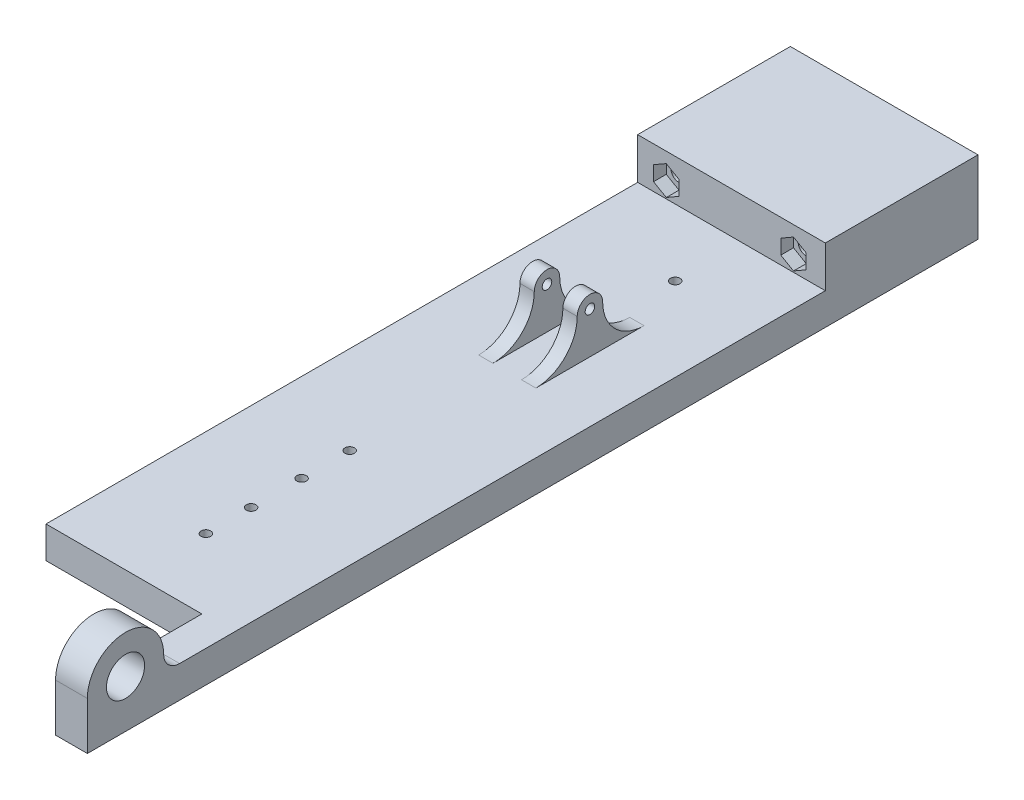
from build123d import *

# Parameters (mm, degrees)
SKETCH1_R           = 6
SKETCH1_R_2         = 1.5
BOSS_EXTRUDE1_DEPTH = 59
SKETCH2_W           = 49
SKETCH2_H           = 46
CUT_EXTRUDE1_DEPTH  = 291.342900723
SKETCH3_W           = 9
SKETCH3_H           = 50
SKETCH3_W_2         = 22
SKETCH3_W_3         = 19
CUT_EXTRUDE2_DEPTH  = 290.584184651
CUT_EXTRUDE3_DEPTH  = 4
SKETCH7_R           = 2.55
CUT_EXTRUDE4_DEPTH  = 82
CUT_EXTRUDE5_DEPTH  = 4
SKETCH9_R           = 1.5
CUT_EXTRUDE6_DEPTH  = 290.584184651


with BuildPart() as part:
    # Sketch1 → Boss-Extrude1 (new body)
    with BuildSketch(Plane(origin=(0, 0, 0), x_dir=(0, 0, -1), z_dir=(1, 0, 0))):
        with BuildLine():
            Line((3, 15), (3, 0))
            Line((3, 0), (283, 0))
            Line((283, 0), (283, 23))
            Line((283, 23), (235, 23))
            Line((235, 23), (235, 10))
            Line((235, 10), (197, 10))
            ThreePointArc((197, 10), (187.807611845, 13.807611845), (184, 23))
            ThreePointArc((184, 23), (180, 27), (176, 23))
            ThreePointArc((176, 23), (172.192388155, 13.807611845), (163, 10))
            Line((163, 10), (32, 10))
            ThreePointArc((32, 10), (28.464466094, 11.464466094), (27, 15))
            ThreePointArc((27, 15), (23.485281374, 23.485281374), (15, 27))
            ThreePointArc((15, 27), (6.514718626, 23.485281374), (3, 15))
        make_face()
        with Locations((15, 15)):
            Circle(SKETCH1_R, mode=Mode.SUBTRACT)
        with Locations((180, 23)):
            Circle(SKETCH1_R_2, mode=Mode.SUBTRACT)
    extrude(amount=BOSS_EXTRUDE1_DEPTH)

    # Sketch2 → Cut-Extrude1 (cut, through all)
    with BuildSketch(Plane.XZ):
        with Locations((24.5, -26)):
            Rectangle(SKETCH2_W, SKETCH2_H)
    extrude(amount=-CUT_EXTRUDE1_DEPTH, mode=Mode.SUBTRACT)

    # Sketch3 → Cut-Extrude2 (cut, through all)
    with BuildSketch(Plane(origin=(0, 10, 0), x_dir=(1, 0, 0), z_dir=(0, 1, 0))):
        with Locations((31, 172)):
            Rectangle(SKETCH3_W, SKETCH3_H)
        with Locations((11, 172)):
            Rectangle(SKETCH3_W_2, SKETCH3_H)
        with Locations((49.5, 172)):
            Rectangle(SKETCH3_W_3, SKETCH3_H)
    extrude(amount=CUT_EXTRUDE2_DEPTH, mode=Mode.SUBTRACT)

    # Sketch6 → Cut-Extrude3 (cut)
    with BuildSketch(Plane(origin=(0, 0, -283), x_dir=(-1, 0, 0), z_dir=(0, 0, -1))):
        Polygon((-49, 10.381197846), (-45, 12.690598923), (-45, 17.309401077), (-49, 19.618802154), (-53, 17.309401077), (-53, 12.690598923), align=None)
        Polygon((-9, 10.381197846), (-5, 12.690598923), (-5, 17.309401077), (-9, 19.618802154), (-13, 17.309401077), (-13, 12.690598923), align=None)
    extrude(amount=-CUT_EXTRUDE3_DEPTH, mode=Mode.SUBTRACT)

    # Sketch7 → Cut-Extrude4 (cut)
    with BuildSketch(Plane(origin=(0, 0, -279), x_dir=(-1, 0, 0), z_dir=(0, 0, -1))):
        with Locations((-49, 15)):
            Circle(SKETCH7_R)
        with Locations((-9, 15)):
            Circle(SKETCH7_R)
    extrude(amount=-CUT_EXTRUDE4_DEPTH, mode=Mode.SUBTRACT)

    # Sketch8 → Cut-Extrude5 (cut)
    with BuildSketch(Plane.XY.offset(-235)):
        Polygon((9, 10.381197846), (13, 12.690598923), (13, 17.309401077), (9, 19.618802154), (5, 17.309401077), (5, 12.690598923), align=None)
        Polygon((49, 10.381197846), (53, 12.690598923), (53, 17.309401077), (49, 19.618802154), (45, 17.309401077), (45, 12.690598923), align=None)
    extrude(amount=-CUT_EXTRUDE5_DEPTH, mode=Mode.SUBTRACT)

    # Sketch9 → Cut-Extrude6 (cut, through all)
    with BuildSketch(Plane(origin=(0, 10, 0), x_dir=(1, 0, 0), z_dir=(0, 1, 0))):
        with Locations(Location((27.75, 71.5, 0), (0, 0, 270))):
            Circle(SKETCH9_R)
        with Locations(Location((27.75, 85.74, 0), (0, 0, 270))):
            Circle(SKETCH9_R)
        with Locations(Location((27.75, 101.6, 0), (0, 0, 270))):
            Circle(SKETCH9_R)
        with Locations(Location((27.75, 116.72, 0), (0, 0, 270))):
            Circle(SKETCH9_R)
        with Locations(Location((32.75, 187.78, 0), (0, 0, 270))):
            Circle(SKETCH9_R)
        with Locations(Location((32.75, 214.06, 0), (0, 0, 270))):
            Circle(SKETCH9_R)
    extrude(amount=-CUT_EXTRUDE6_DEPTH, mode=Mode.SUBTRACT)


solid = part.part
